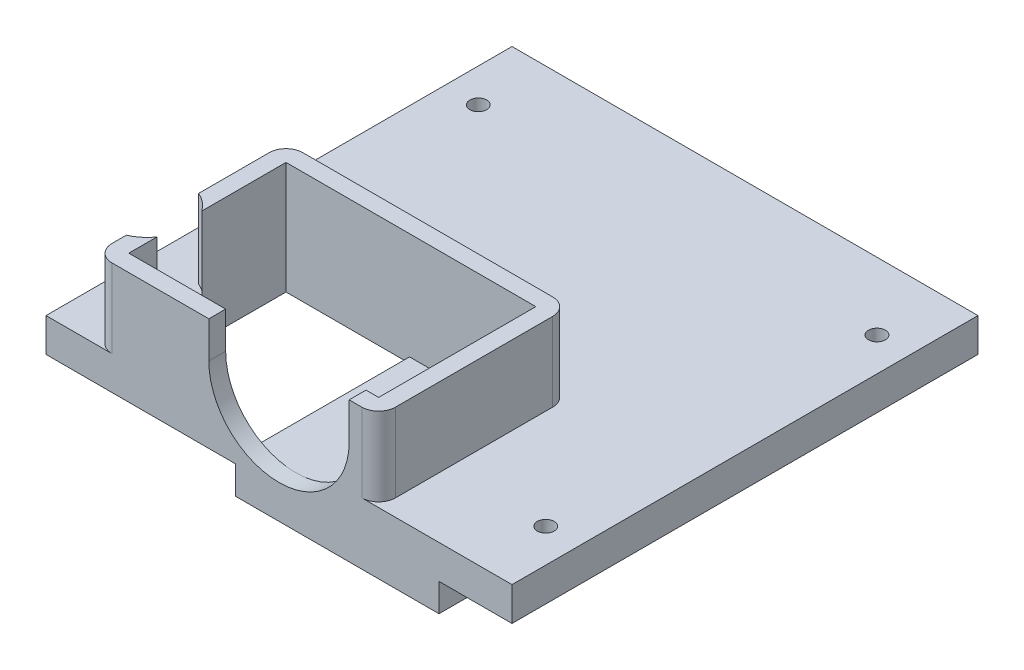
from build123d import *

# Parameters (mm, degrees)
SKETCH1_W                                = 83
SKETCH1_H                                = 83
BOSS_EXTRUDE1_DEPTH                      = 6
SKETCH2_R                                = 1.5
CUT_EXTRUDE1_DEPTH                       = 118.532974097
SKETCH5_W                                = 50.5
SKETCH5_H                                = 34
BOSS_EXTRUDE2_DEPTH                      = 22
SKETCH6_W                                = 44.5
SKETCH6_H                                = 28
CUT_EXTRUDE5_DEPTH                       = 25
FILLET1_R                                = 3
SKETCH8_R                                = 12.5
CUT_EXTRUDE6_DEPTH                       = 10
CUT_EXTRUDE7_DEPTH                       = 121.673112167
CUT_EXTRUDE7_DEPTH_BACK                  = 121.673112167
SKETCH9_W                                = 83
SKETCH9_H                                = 8
CUT_EXTRUDE8_DEPTH                       = 3
MIRROR1_AT_THE_SECOND_PLANE_COPY_1_DEPTH = 3
CUT_EXTRUDE9_DEPTH                       = 14
CUT_EXTRUDE10_DEPTH                      = 10
CUT_EXTRUDE11_DEPTH                      = 10
BOSS_EXTRUDE3_DEPTH                      = 3
CUT_EXTRUDE14_DEPTH                      = 4
SKETCH20_W                               = 13.564659966
SKETCH20_H                               = 7
CUT_EXTRUDE15_DEPTH                      = 4
BOSS_EXTRUDE4_DEPTH                      = 5
BOSS_EXTRUDE4_DEPTH_BACK                 = 1
SKETCH21_W                               = 36.25
SKETCH21_H                               = 37
FILLET2_R                                = 5


with BuildPart() as part:
    # Sketch1 → Boss-Extrude1 (new body)
    with BuildSketch(Plane(origin=(0, 0, 0), x_dir=(1, 0, 0), z_dir=(0, 1, 0))):
        with Locations((41.5, 41.5)):
            Rectangle(SKETCH1_W, SKETCH1_H)
    extrude(amount=BOSS_EXTRUDE1_DEPTH)

    # Sketch2 → Cut-Extrude1 (cut, through all)
    with BuildSketch(Plane(origin=(0, 6, 0), x_dir=(1, 0, 0), z_dir=(0, 1, 0))):
        with Locations(Location((6, 71, 0), (0, 0, 270))):
            Circle(SKETCH2_R)
        with Locations(Location((6, 12, 0), (0, 0, 270))):
            Circle(SKETCH2_R)
        with Locations(Location((77, 12, 0), (0, 0, 270))):
            Circle(SKETCH2_R)
        with Locations(Location((77, 71, 0), (0, 0, 270))):
            Circle(SKETCH2_R)
    extrude(amount=-CUT_EXTRUDE1_DEPTH, mode=Mode.SUBTRACT)

    # Sketch5 → Boss-Extrude2 (add)
    with BuildSketch(Plane(origin=(0, 6, 0), x_dir=(1, 0, 0), z_dir=(0, 1, 0))):
        with Locations((34, 17)):
            Rectangle(SKETCH5_W, SKETCH5_H)
    extrude(amount=BOSS_EXTRUDE2_DEPTH)

    # Sketch6 → Cut-Extrude5 (cut)
    with BuildSketch(Plane(origin=(0, 28, 0), x_dir=(1, 0, 0), z_dir=(0, 1, 0))):
        with Locations((34, 17)):
            Rectangle(SKETCH6_W, SKETCH6_H)
    extrude(amount=-CUT_EXTRUDE5_DEPTH, mode=Mode.SUBTRACT)

    # Fillet1
    fillet1_edges = [part.edges().sort_by_distance(p)[0] for p in [
        (59.25, 17, -34),
        (8.75, 17, -34),
        (8.75, 17, 0),
        (59.25, 17, 0),
    ]]
    fillet(fillet1_edges, radius=FILLET1_R)

    # Sketch8 → Cut-Extrude6 (cut)
    with BuildSketch(Plane.XY):
        with Locations((41.5, 13.5)):
            Circle(SKETCH8_R)
    extrude(amount=-CUT_EXTRUDE6_DEPTH, mode=Mode.SUBTRACT)

    # Sketch9 → Cut-Extrude7 (cut, two sides: drawn at the far end of the back side and taken through both)
    with BuildSketch(Plane.XY.offset(-CUT_EXTRUDE7_DEPTH_BACK)):
        with Locations((41.5, 24)):
            Rectangle(SKETCH9_W, SKETCH9_H)
    extrude(amount=CUT_EXTRUDE7_DEPTH + CUT_EXTRUDE7_DEPTH_BACK, mode=Mode.SUBTRACT)

    # Sketch11 → Cut-Extrude8 (cut)
    with BuildSketch(Plane.XZ):
        Polygon((3, -9), (13, -9), (13, -15), (8, -21), (3, -21), align=None)
    cut_extrude8 = extrude(amount=-CUT_EXTRUDE8_DEPTH, mode=Mode.SUBTRACT)

    # Mirror1: Cut-Extrude8 across plane
    add(cut_extrude8.mirror(Plane.XY.offset(-41.5)), mode=Mode.SUBTRACT)

    # Mirror1 at the second plane: Cut-Extrude8 across plane
    add(cut_extrude8.mirror(Plane.ZY.offset(-41.5)), mode=Mode.SUBTRACT)

    # Mirror1 at the second plane copy 1 sketc → Mirror1 at the second plane copy 1 (cut)
    with BuildSketch(Plane(origin=(83, 0, -83), x_dir=(-1, 0, 0), z_dir=(0, -1, 0))):
        Polygon((3, -9), (13, -9), (13, -15), (8, -21), (3, -21), align=None)
    extrude(amount=-MIRROR1_AT_THE_SECOND_PLANE_COPY_1_DEPTH, mode=Mode.SUBTRACT)

    # Sketch13 → Cut-Extrude9 (cut)
    with BuildSketch(Plane(origin=(0, 20, 0), x_dir=(1, 0, 0), z_dir=(0, 1, 0))):
        with BuildLine():
            Line((11.75, 8.007820144), (11.75, 15.992179856))
            ThreePointArc((11.75, 15.992179856), (10.422332723, 17.426137972), (8.75, 18.437196595))
            Line((8.75, 18.437196595), (8.75, 5.562803405))
            ThreePointArc((8.75, 5.562803405), (10.422332723, 6.573862028), (11.75, 8.007820144))
        make_face()
    extrude(amount=-CUT_EXTRUDE9_DEPTH, mode=Mode.SUBTRACT)

    # Sketch14 → Cut-Extrude10 (cut)
    with BuildSketch(Plane.XY):
        Polygon((29, 13.5), (29, 20), (30.822921748, 20), align=None)
    extrude(amount=-CUT_EXTRUDE10_DEPTH, mode=Mode.SUBTRACT)

    # Sketch15 → Cut-Extrude11 (cut)
    with BuildSketch(Plane.XY):
        Polygon((54, 20), (54, 13.5), (52.177078252, 20), align=None)
    extrude(amount=-CUT_EXTRUDE11_DEPTH, mode=Mode.SUBTRACT)

    # Sketch17 → Boss-Extrude3 (add)
    with BuildSketch(Plane.XZ):
        Polygon((9.666666667, -9), (9.666666667, -19), (13, -15), (13, -9), align=None)
    extrude(amount=-BOSS_EXTRUDE3_DEPTH)

    # Sketch18 → Cut-Extrude14 (cut)
    with BuildSketch(Plane(origin=(0, 3, 0), x_dir=(1, 0, 0), z_dir=(0, 1, 0))):
        Polygon((34.717670017, 3), (34.717670017, 10), (48.282329983, 10), (48.282329983, 3), (56.25, 3), (56.25, 31), (11.75, 31), (11.75, 3), align=None)
    extrude(amount=-CUT_EXTRUDE14_DEPTH, mode=Mode.SUBTRACT)

    # Sketch20 → Cut-Extrude15 (cut)
    with BuildSketch(Plane.XZ):
        with Locations((41.5, -6.5)):
            Rectangle(SKETCH20_W, SKETCH20_H)
    extrude(amount=-CUT_EXTRUDE15_DEPTH, mode=Mode.SUBTRACT)

    # Sketch21 → Boss-Extrude4 (add, two sides: drawn at the far end of the back side and taken through both)
    with BuildSketch(Plane.XZ.offset(-BOSS_EXTRUDE4_DEPTH_BACK)):
        with Locations((51.875, -18.5)):
            Rectangle(SKETCH21_W, SKETCH21_H)
    extrude(amount=BOSS_EXTRUDE4_DEPTH + BOSS_EXTRUDE4_DEPTH_BACK)

    # Fillet2
    fillet2_edges = [part.edges().sort_by_distance(p)[0] for p in [
        (33.75, -2.5, -37),
        (70, -2.5, -37),
    ]]
    fillet(fillet2_edges, radius=FILLET2_R)


solid = part.part
